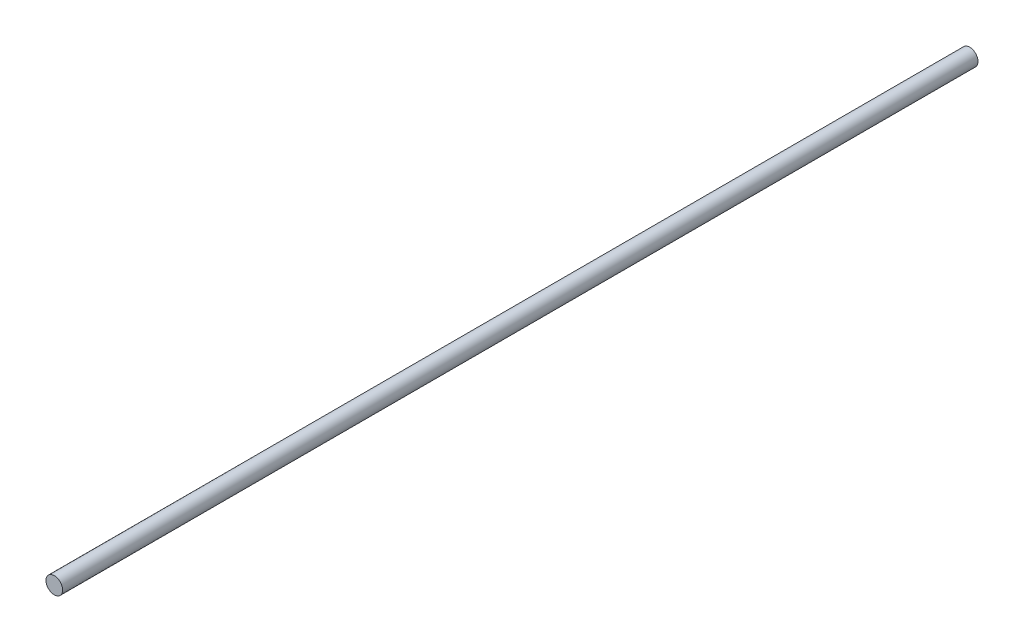
from build123d import *

# Parameters (mm, degrees)
SKETCH1_R           = 8
BOSS_EXTRUDE1_DEPTH = 880
SKETCH4_R           = 2.1
CUT_EXTRUDE2_DEPTH  = 12.4
LPATTERN1_COUNT     = 5
LPATTERN1_PITCH     = 150


with BuildPart() as part:
    # Sketch1 → Boss-Extrude1 (new body)
    with BuildSketch(Plane.XY):
        Circle(SKETCH1_R)
    extrude(amount=BOSS_EXTRUDE1_DEPTH)

    # Sketch4 → Cut-Extrude2 (cut)
    with BuildSketch(Plane(origin=(0, -8, 0), x_dir=(-1, 0, 0), z_dir=(0, 1, 0))):
        with Locations(Location((0, 100, 0), (0, 0, 270))):
            Circle(SKETCH4_R)
    cut_extrude2 = extrude(amount=CUT_EXTRUDE2_DEPTH, mode=Mode.SUBTRACT)

    # LPattern1: Cut-Extrude2 ×5
    with Locations(*[(0, 0, i * LPATTERN1_PITCH) for i in range(1, LPATTERN1_COUNT)]):
        add(cut_extrude2, mode=Mode.SUBTRACT)


solid = part.part
